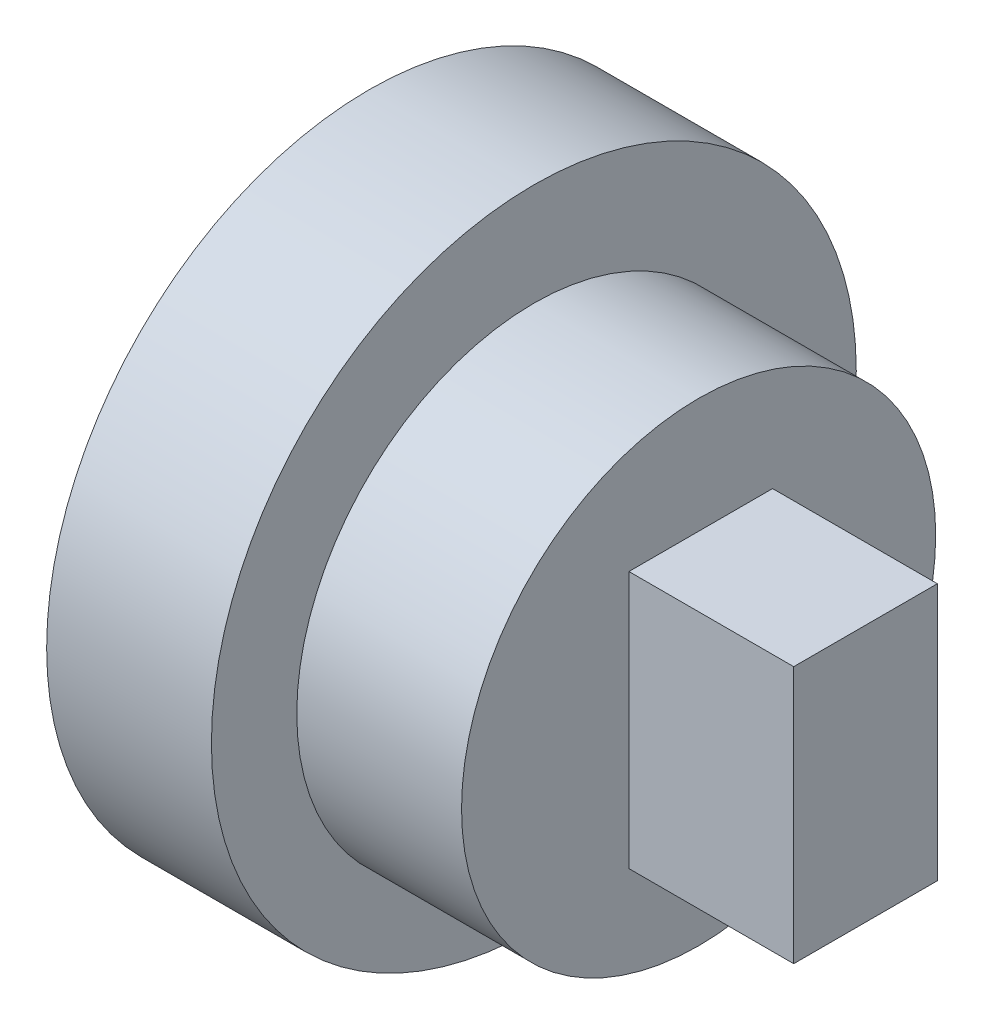
from build123d import *

# Parameters (mm, degrees)
SKETCH1_R           = 19.567441598
BOSS_EXTRUDE1_DEPTH = 10
SKETCH2_R           = 14.388112676
BOSS_EXTRUDE2_DEPTH = 10
SKETCH3_W           = 8.717473042
SKETCH3_H           = 15.61355637
BOSS_EXTRUDE3_DEPTH = 10


with BuildPart() as part:
    # Sketch1 → Boss-Extrude1 (new body)
    with BuildSketch(Plane(origin=(0, 0, 0), x_dir=(0, 0, -1), z_dir=(1, 0, 0))):
        with Locations((0, 1.041985539)):
            Circle(SKETCH1_R)
    extrude(amount=BOSS_EXTRUDE1_DEPTH)

    # Sketch2 → Boss-Extrude2 (add)
    with BuildSketch(Plane(origin=(10, 0, 0), x_dir=(0, 0, -1), z_dir=(1, 0, 0))):
        Circle(SKETCH2_R)
    extrude(amount=BOSS_EXTRUDE2_DEPTH)

    # Sketch3 → Boss-Extrude3 (add)
    with BuildSketch(Plane(origin=(20, 0, 0), x_dir=(0, 0, -1), z_dir=(1, 0, 0))):
        with Locations((0.129497686, -0.406254906)):
            Rectangle(SKETCH3_W, SKETCH3_H)
    extrude(amount=BOSS_EXTRUDE3_DEPTH)


solid = part.part
